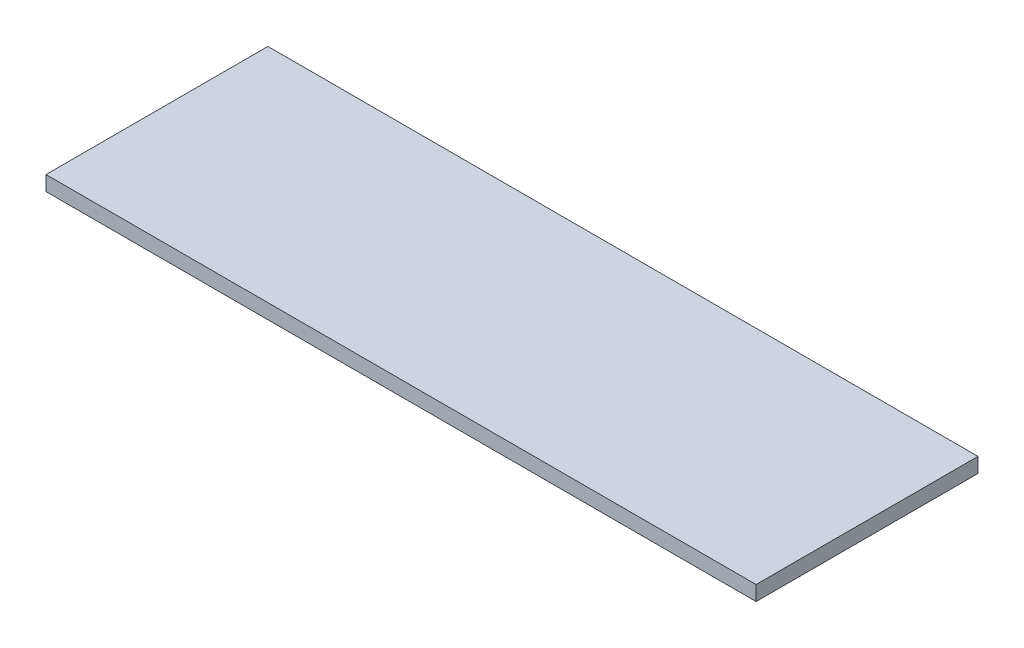
from build123d import *

# Parameters (mm, degrees)
SKETCH_1_W      = 288
SKETCH_1_H      = 90
EXTRUDE_1_DEPTH = 6


with BuildPart() as part:
    # 草图1 → 凸台-拉伸1 (new body)
    with BuildSketch(Plane(origin=(0, 0, 0), x_dir=(1, 0, 0), z_dir=(0, 1, 0))):
        with Locations((144, 45)):
            Rectangle(SKETCH_1_W, SKETCH_1_H)
    extrude(amount=EXTRUDE_1_DEPTH)


solid = part.part
